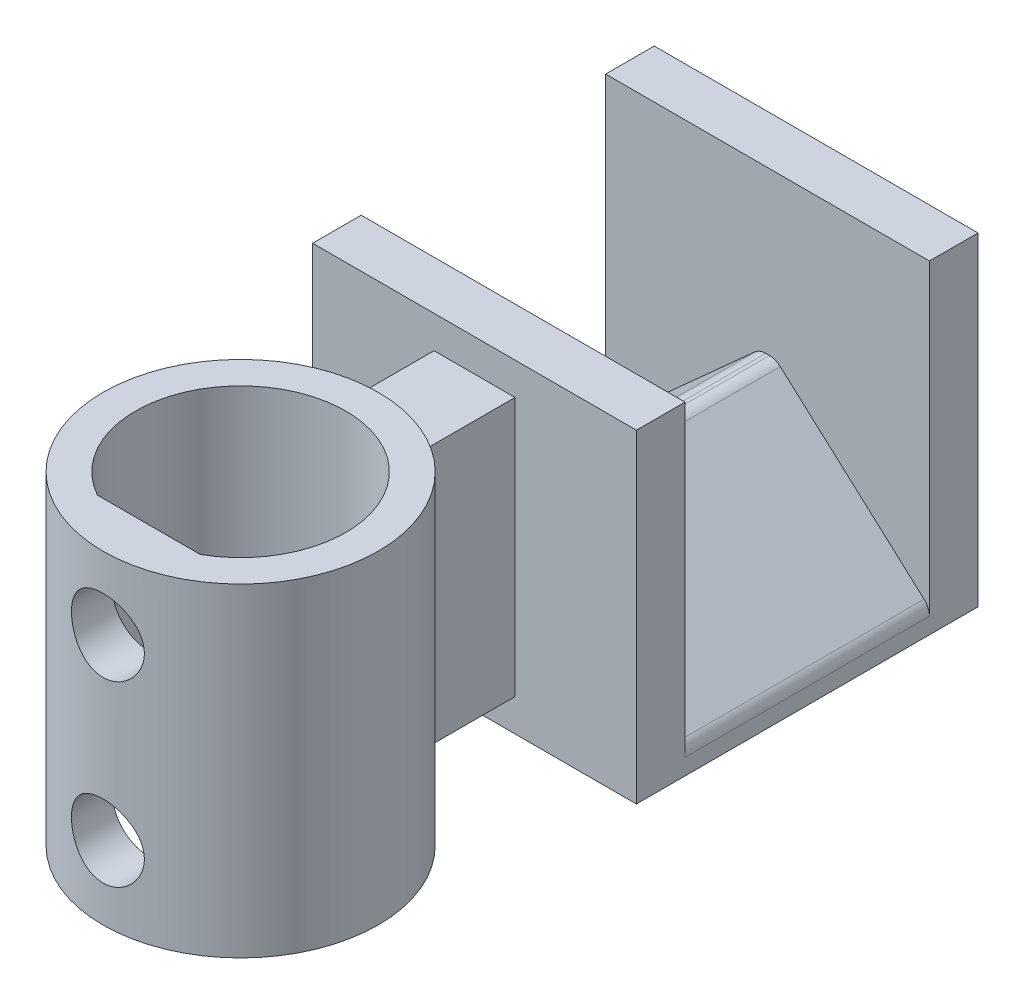
from build123d import *

# Parameters (mm, degrees)
SKETCH2_W                       = 20
SKETCH2_H                       = 10
BOSS_EXTRUDE1_DEPTH             = 7.55
CHAMFER1_SIZE                   = 9.5
CHAMFER1_SIZE2                  = 8.553838421
FILLET3_R                       = 1
SKETCH3_W                       = 20
SKETCH3_H                       = 20
BOSS_EXTRUDE2_DEPTH             = 3
BOSS_EXTRUDE3_REACH             = 22.888
SKETCH6_R                       = 8.5
BOSS_EXTRUDE3_DIRECTION_2_REACH = 22.888
BOSS_EXTRUDE4_REACH             = 31.184
BOSS_EXTRUDE4_END_RADIUS        = 8.5
SKETCH5_W                       = 5
SKETCH5_H                       = 16
CUT_EXTRUDE1_REACH              = 37.473
CUT_EXTRUDE1_END_RADIUS         = 8.5
SKETCH7_R                       = 2.25


with BuildPart() as part:
    # Sketch2 → Boss-Extrude1 (new, symmetric)
    with BuildSketch(Plane.XY):
        Rectangle(SKETCH2_W, SKETCH2_H)
    extrude(amount=BOSS_EXTRUDE1_DEPTH, both=True)

    # Chamfer1
    chamfer1_edges = [part.edges().sort_by_distance(p)[0] for p in [
        (-10, 5, 0),
        (10, 5, 0),
    ]]
    chamfer1_side = [part.faces().sort_by_distance(p)[0] for p in [
        (0, 5, 0),
    ]]
    chamfer(chamfer1_edges, length=CHAMFER1_SIZE, length2=CHAMFER1_SIZE2, reference=chamfer1_side[0])

    # Fillet3
    fillet3_edges = [part.edges().sort_by_distance(p)[0] for p in [
        (-0.5, 5, 0),
        (0.5, 5, 0),
        (10, -3.553838421, 0),
        (-10, -3.553838421, 0),
    ]]
    fillet(fillet3_edges, radius=FILLET3_R)

    # Sketch3 → Boss-Extrude2 (add)
    with BuildSketch(Plane.XY.offset(7.55)):
        with Locations((0, 5)):
            Rectangle(SKETCH3_W, SKETCH3_H)
    boss_extrude2 = extrude(amount=BOSS_EXTRUDE2_DEPTH)

    # Mirror1: Boss-Extrude2 across plane
    add(boss_extrude2.mirror(Plane.XY))


with BuildPart() as body_2:

    # Boss-Extrude3: up to this face of the body (flat: up to its plane)
    boss_extrude3_end = Plane(part.part.faces().sort_by_distance((0, 15, 9.05))[0])
    # Sketch6 → Boss-Extrude3 (new, up to the picked face)
    with BuildSketch(Plane(origin=(0, 0, 0), x_dir=(1, 0, 0), z_dir=(0, 1, 0)), mode=Mode.PRIVATE) as boss_extrude3_sk1:
        with Locations(Location((0, -25, 0), (0, 0, 90))):
            Circle(SKETCH6_R)
        with BuildLine():
            Line((3.175, -30.671805268), (-3.175, -30.671805268))
            ThreePointArc((-3.175, -30.671805268), (0, -18.5), (3.175, -30.671805268))
        make_face(mode=Mode.SUBTRACT)
    boss_extrude3_tool1 = split(extrude(boss_extrude3_sk1.sketch, amount=BOSS_EXTRUDE3_REACH, mode=Mode.PRIVATE), bisect_by=boss_extrude3_end, keep=Keep.BOTH, mode=Mode.PRIVATE)
    add(boss_extrude3_tool1.solids().sort_by(Axis((0, 0, 33.259584), (0, 1, 0)))[0])


    # Boss-Extrude3 direction 2: up to this face of the body (flat: up to its plane)
    boss_extrude3_direction_2_end = Plane(part.part.faces().sort_by_distance((0, -5, 0))[0])
    # Sketch6 → Boss-Extrude3 direction 2 (add, up to the picked face)
    with BuildSketch(Plane(origin=(0, 0, 0), x_dir=(1, 0, 0), z_dir=(0, 1, 0)), mode=Mode.PRIVATE) as boss_extrude3_direction_2_sk1:
        with Locations(Location((0, -25, 0), (0, 0, 90))):
            Circle(SKETCH6_R)
        with BuildLine():
            Line((3.175, -30.671805268), (-3.175, -30.671805268))
            ThreePointArc((-3.175, -30.671805268), (0, -18.5), (3.175, -30.671805268))
        make_face(mode=Mode.SUBTRACT)
    boss_extrude3_direction_2_tool1 = split(extrude(boss_extrude3_direction_2_sk1.sketch, amount=-BOSS_EXTRUDE3_DIRECTION_2_REACH, mode=Mode.PRIVATE), bisect_by=boss_extrude3_direction_2_end, keep=Keep.BOTH, mode=Mode.PRIVATE)
    add(boss_extrude3_direction_2_tool1.solids().sort_by(Axis((0, 0, 33.259584), (0, -1, 0)))[0])


with BuildPart() as part_1:
    add(part.part)

    add(body_2.part)  # Boss-Extrude4 merges body 2
    # Boss-Extrude4: up to this cylinder (the profile starts outside it)
    boss_extrude4_end = Plane(origin=(0, 5, 25), z_dir=(0, -1, 0)) * Cylinder(BOSS_EXTRUDE4_END_RADIUS, 80.368, mode=Mode.PRIVATE)
    # Sketch5 → Boss-Extrude4 (add, up to the surface)
    with BuildSketch(Plane.XY.offset(10.55), mode=Mode.PRIVATE) as boss_extrude4_sk1:
        with Locations((0, 5)):
            Rectangle(SKETCH5_W, SKETCH5_H)
    boss_extrude4_tool1 = extrude(boss_extrude4_sk1.sketch, amount=BOSS_EXTRUDE4_REACH, mode=Mode.PRIVATE) - boss_extrude4_end
    add(boss_extrude4_tool1.solids().sort_by_distance((0, 5, 10.55))[0])

    # Cut-Extrude1: up to this cylinder (the profile starts inside it)
    cut_extrude1_end = Plane(origin=(0, 5, 25), z_dir=(0, -1, 0)) * Cylinder(CUT_EXTRUDE1_END_RADIUS, 103.946, mode=Mode.PRIVATE)
    # Sketch7 → Cut-Extrude1 (cut, up to the surface)
    with BuildSketch(Plane.XY.offset(20), mode=Mode.PRIVATE) as cut_extrude1_sk1:
        with Locations(Location((0, 10.5, 0), (0, 0, 180))):
            Circle(SKETCH7_R)
    cut_extrude1_tool1 = extrude(cut_extrude1_sk1.sketch, amount=CUT_EXTRUDE1_REACH, mode=Mode.PRIVATE) & cut_extrude1_end
    add(cut_extrude1_tool1.solids().sort_by_distance((0, 10.5, 20))[0], mode=Mode.SUBTRACT)
    # Sketch7 → Cut-Extrude1 (cut, up to the surface)
    with BuildSketch(Plane.XY.offset(20), mode=Mode.PRIVATE) as cut_extrude1_sk2:
        with Locations(Location((0, -0.5, 0), (0, 0, 180))):
            Circle(SKETCH7_R)
    cut_extrude1_tool2 = extrude(cut_extrude1_sk2.sketch, amount=CUT_EXTRUDE1_REACH, mode=Mode.PRIVATE) & cut_extrude1_end
    add(cut_extrude1_tool2.solids().sort_by_distance((0, -0.5, 20))[0], mode=Mode.SUBTRACT)


solid = part_1.part
